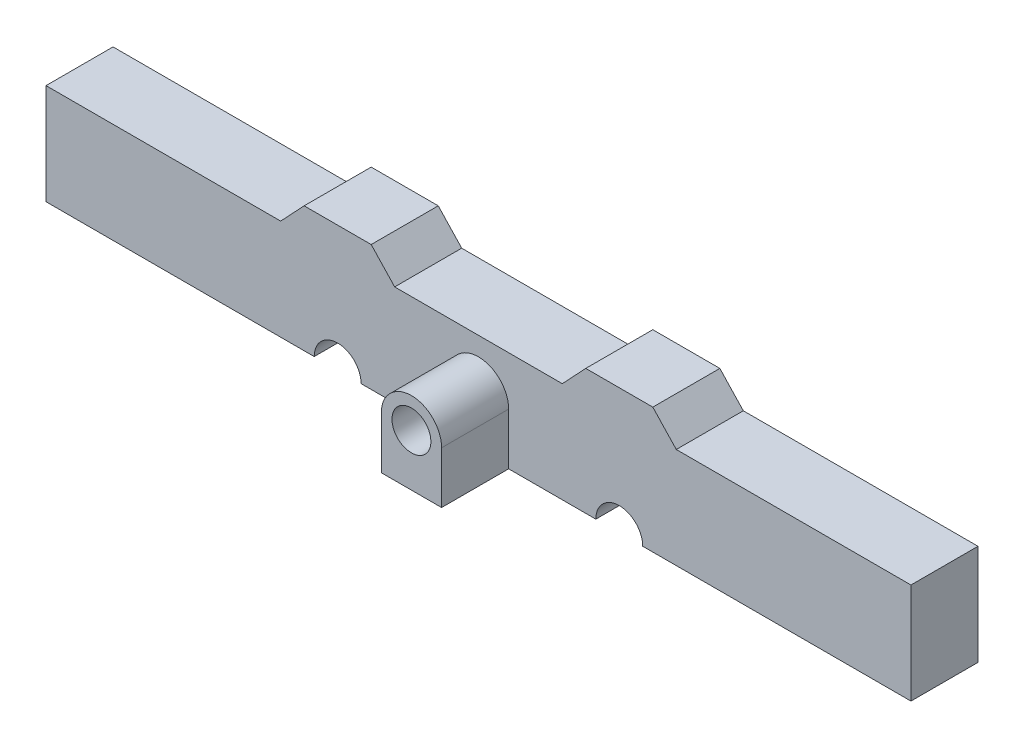
from build123d import *

# Parameters (mm, degrees)
BOSS_EXTRUDE1_DEPTH = 10
BOSS_EXTRUDE2_START = -2
BOSS_EXTRUDE2_DEPTH = 2
BOSS_EXTRUDE3_DEPTH = 2
SKETCH6_R           = 4.5
SKETCH6_R_2         = 2.9
BOSS_EXTRUDE4_DEPTH = 10
CUT_EXTRUDE1_START  = -8
SKETCH7_R           = 2.9
CUT_EXTRUDE1_DEPTH  = 8
SKETCH9_R           = 2.5
BOSS_EXTRUDE5_DEPTH = 10
BOSS_EXTRUDE6_START = -10
BOSS_EXTRUDE6_DEPTH = 10


with BuildPart() as part:
    # Sketch1 → Boss-Extrude1 (new body)
    with BuildSketch(Plane.XY):
        with BuildLine():
            Line((0, 0), (0, 15))
            Line((0, 15), (35, 15))
            Line((35, 15), (38.5, 18.724245534))
            Line((38.5, 18.724245534), (48.5, 18.724245534))
            Line((48.5, 18.724245534), (52, 15))
            Line((52, 15), (77.000664221, 15))
            Line((77.000664221, 15), (80.5, 18.723808414))
            Line((80.5, 18.723808414), (85.5, 18.723808414))
            Line((85.5, 18.723808414), (90.5, 18.723808414))
            Line((90.5, 18.723808414), (93.999335779, 15))
            Line((93.999335779, 15), (129, 15))
            Line((129, 15), (129, 0))
            Line((129, 0), (89, 0))
            ThreePointArc((89, 0), (85.5, 3.5), (82, 0))
            Line((82, 0), (47, 0))
            ThreePointArc((47, 0), (43.5, 3.5), (40, 0))
            Line((40, 0), (0, 0))
        make_face()
        with BuildLine():
            Line((2, 13), (35.865019983, 13))
            Line((35.865019983, 13), (39.365019983, 16.724245534))
            Line((39.365019983, 16.724245534), (47.634980017, 16.724245534))
            Line((47.634980017, 16.724245534), (51.134980017, 13))
            Line((51.134980017, 13), (77.865727104, 13))
            Line((77.865727104, 13), (81.365062883, 16.723808414))
            Line((81.365062883, 16.723808414), (85.5, 16.723808414))
            Line((85.5, 16.723808414), (89.634937117, 16.723808414))
            Line((89.634937117, 16.723808414), (93.134272896, 13))
            Line((93.134272896, 13), (127, 13))
            Line((127, 13), (127, 2))
            Line((127, 2), (90.623475383, 2))
            ThreePointArc((90.623475383, 2), (85.5, 5.5), (80.376524617, 2))
            Line((80.376524617, 2), (48.623475383, 2))
            ThreePointArc((48.623475383, 2), (43.5, 5.5), (38.376524617, 2))
            Line((38.376524617, 2), (2, 2))
            Line((2, 2), (2, 13))
        make_face(mode=Mode.SUBTRACT)
    extrude(amount=BOSS_EXTRUDE1_DEPTH)

    # Sketch2 → Boss-Extrude2 (add)
    with BuildSketch(Plane.XY.offset(10).offset(BOSS_EXTRUDE2_START)):
        with BuildLine():
            Line((129, 0), (129, 15))
            Line((129, 15), (93.999335779, 15))
            Line((93.999335779, 15), (90.5, 18.723808414))
            Line((90.5, 18.723808414), (80.5, 18.723808414))
            Line((80.5, 18.723808414), (77.000664221, 15))
            Line((77.000664221, 15), (52, 15))
            Line((52, 15), (48.5, 18.724245534))
            Line((48.5, 18.724245534), (38.5, 18.724245534))
            Line((38.5, 18.724245534), (35, 15))
            Line((35, 15), (0, 15))
            Line((0, 15), (0, 0))
            Line((0, 0), (40, 0))
            ThreePointArc((40, 0), (43.5, 3.5), (47, 0))
            Line((47, 0), (82, 0))
            ThreePointArc((82, 0), (85.5, 3.5), (89, 0))
            Line((89, 0), (129, 0))
        make_face()
    extrude(amount=BOSS_EXTRUDE2_DEPTH)

    # Sketch3 → Boss-Extrude3 (add)
    with BuildSketch(Plane(origin=(0, 0, 0), x_dir=(-1, 0, 0), z_dir=(0, 0, -1))):
        with BuildLine():
            Line((-52, 15), (-77.000664221, 15))
            Line((-77.000664221, 15), (-80.5, 18.723808414))
            Line((-80.5, 18.723808414), (-90.5, 18.723808414))
            Line((-90.5, 18.723808414), (-93.999335779, 15))
            Line((-93.999335779, 15), (-129, 15))
            Line((-129, 15), (-129, 0))
            Line((-129, 0), (-89, 0))
            ThreePointArc((-89, 0), (-85.5, 3.5), (-82, 0))
            Line((-82, 0), (-47, 0))
            ThreePointArc((-47, 0), (-43.5, 3.5), (-40, 0))
            Line((-40, 0), (0, 0))
            Line((0, 0), (0, 15))
            Line((0, 15), (-35, 15))
            Line((-35, 15), (-38.5, 18.724245534))
            Line((-38.5, 18.724245534), (-48.5, 18.724245534))
            Line((-48.5, 18.724245534), (-52, 15))
        make_face()
    extrude(amount=-BOSS_EXTRUDE3_DEPTH)

    # Sketch6 → Boss-Extrude4 (add)
    with BuildSketch(Plane.XY.offset(10)):
        with Locations(Location((64.500332111, 7.717300047, 0), (0, 0, 180))):
            Circle(SKETCH6_R)
        with Locations((64.500332111, 7.717300047)):
            Circle(SKETCH6_R_2, mode=Mode.SUBTRACT)
    extrude(amount=BOSS_EXTRUDE4_DEPTH)

    # Sketch7 → Cut-Extrude1 (cut)
    with BuildSketch(Plane.XY.offset(10).offset(CUT_EXTRUDE1_START)):
        with Locations((64.500332111, 7.717300047)):
            Circle(SKETCH7_R)
    extrude(amount=CUT_EXTRUDE1_DEPTH, mode=Mode.SUBTRACT)

    # Sketch9 → Boss-Extrude5 (add)
    with BuildSketch(Plane.XY.offset(10)):
        with Locations((119, 7.5)):
            Circle(SKETCH9_R)
        with Locations((103, 7.5)):
            Circle(SKETCH9_R)
        with Locations((76.500332111, 7.5)):
            Circle(SKETCH9_R)
        with Locations((10.000664221, 7.5)):
            Circle(SKETCH9_R)
        with Locations((26.000664221, 7.5)):
            Circle(SKETCH9_R)
        with Locations((52.500332111, 7.5)):
            Circle(SKETCH9_R)
    extrude(amount=-BOSS_EXTRUDE5_DEPTH)

    # Sketch10 → Boss-Extrude6 (add)
    with BuildSketch(Plane.XY.offset(20).offset(BOSS_EXTRUDE6_START)):
        with BuildLine():
            Line((60.000332111, 7.717300047), (60.000332111, 0))
            Line((60.000332111, 0), (69.000332111, 0))
            Line((69.000332111, 0), (69.000332111, 7.717300047))
            ThreePointArc((69.000332111, 7.717300047), (64.500332111, 3.217300047), (60.000332111, 7.717300047))
        make_face()
    extrude(amount=BOSS_EXTRUDE6_DEPTH)


solid = part.part
